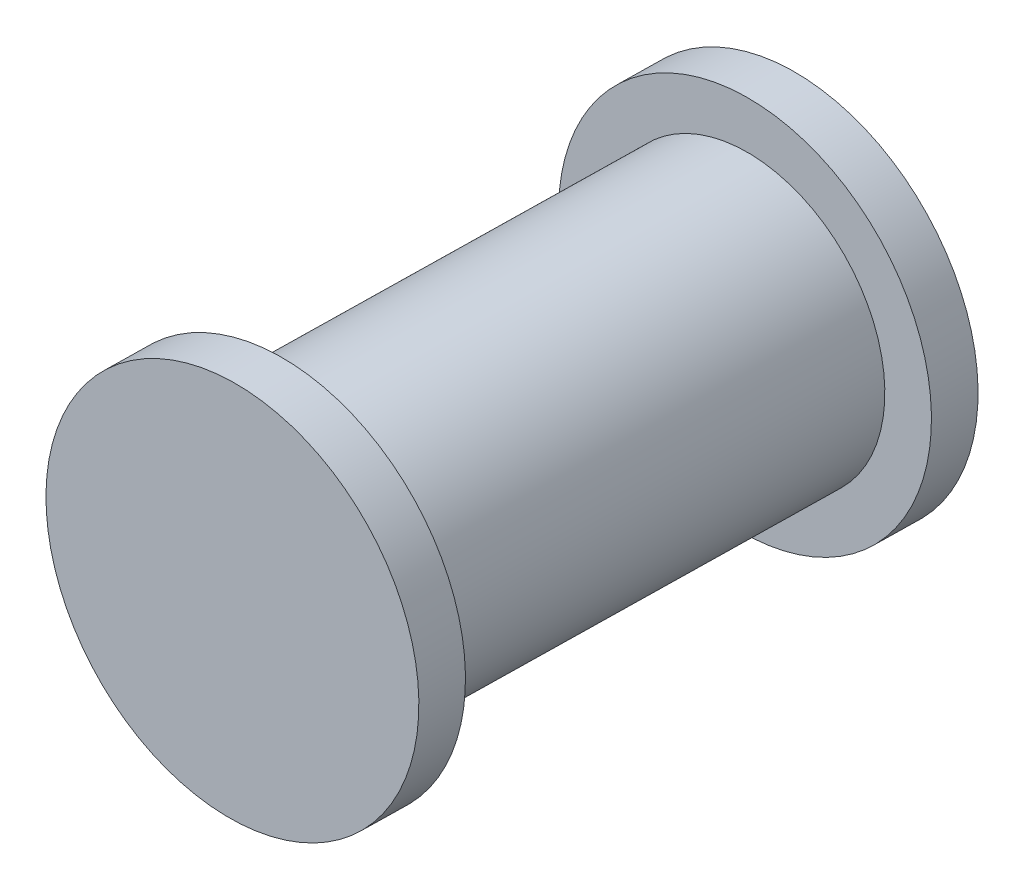
from build123d import *

# Parameters (mm, degrees)
BODY_MOVE_COPY1_ANGLE = 119.424338974


with BuildPart() as part:
    # Sketch1 → Revolve1 (revolve)
    with BuildSketch(Plane.XY, mode=Mode.PRIVATE) as revolve1_sk:
        Polygon((0, 0), (0, 12), (-4, 12), (-4, 11), (-3, 11), (-3, 1), (-4, 1), (-4, 0), align=None)
    revolve(revolve1_sk.sketch.rotate(Axis((0, 0, 0), (0, 1, 0)), 270), axis=Axis((0, 0, 0), (0, 1, 0)))


with BuildPart() as part_1:
    # Body-Move/Copy1: moved
    add(part.part.moved(Location((0, 0, 0))).rotate(Axis((-2.346629399, 4.612052575, -2.346629399), (0.5739619558891293, 0.5840679295973761, 0.5739619558888548)), BODY_MOVE_COPY1_ANGLE))


solid = part_1.part
